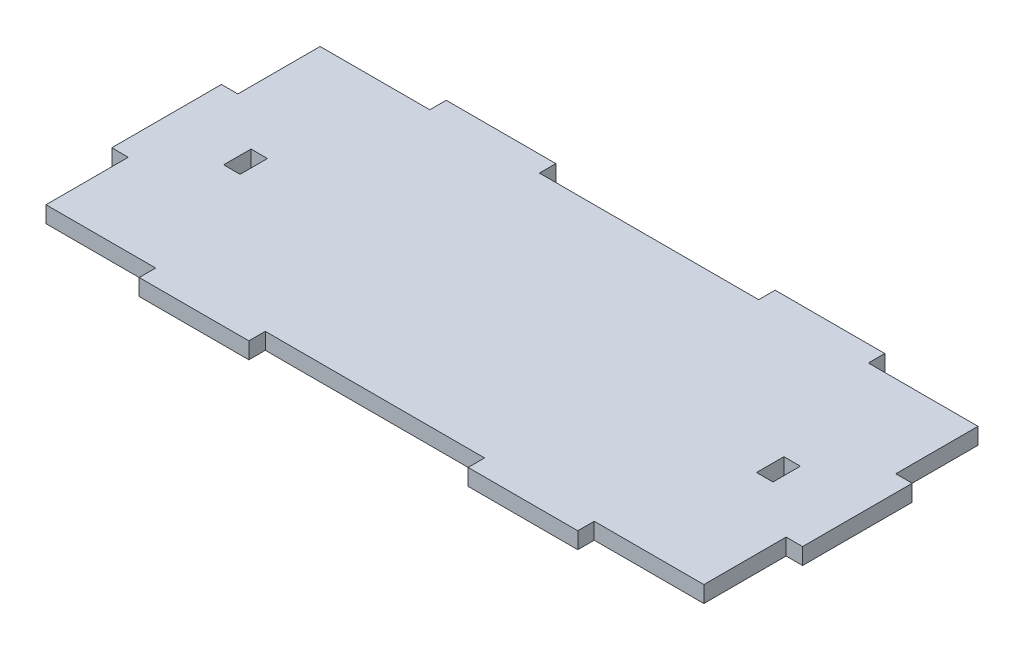
from build123d import *

# Parameters (mm, degrees)
SKETCH2_W           = 3
SKETCH2_H           = 5
BOSS_EXTRUDE1_DEPTH = 3


with BuildPart() as part:
    # Sketch2 → Boss-Extrude1 (new body)
    with BuildSketch(Plane(origin=(0, 0, 0), x_dir=(1, 0, 0), z_dir=(0, 1, 0))):
        Polygon((0, 0), (20, 0), (20, -3), (40, -3), (40, 0), (80, 0), (80, -3), (100, -3), (100, 0), (120, 0), (120, 15), (123, 15), (123, 35), (120, 35), (120, 50), (100, 50), (100, 53), (80, 53), (80, 50), (40, 50), (40, 53), (20, 53), (20, 50), (0, 50), (0, 35), (-3, 35), (-3, 15), (0, 15), align=None)
        with Locations((11.4, 25)):
            Rectangle(SKETCH2_W, SKETCH2_H, mode=Mode.SUBTRACT)
        with Locations((108.6, 25)):
            Rectangle(SKETCH2_W, SKETCH2_H, mode=Mode.SUBTRACT)
    extrude(amount=BOSS_EXTRUDE1_DEPTH)


solid = part.part
